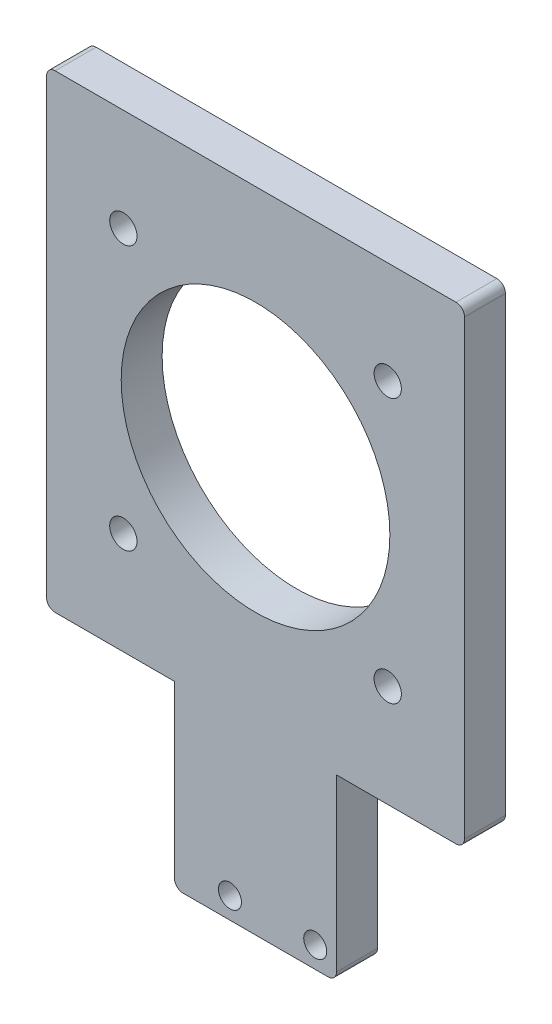
from build123d import *

# Parameters (mm, degrees)
ESQUISSE1_R        = 15.75
ESQUISSE1_R_2      = 1.6
ESQUISSE1_R_3      = 1.35
BOSS_EXTRU_1_DEPTH = 4.8


with BuildPart() as part:
    # Esquisse1 → Boss.-Extru.1 (new body)
    with BuildSketch(Plane(origin=(0, 0, 0), x_dir=(-1, 0, 0), z_dir=(0, 0, -1))):
        with BuildLine():
            Line((-12.0004012, 3.650219609), (-12.0004012, 56.650219609))
            ThreePointArc((-12.0004012, 56.650219609), (-12.293294419, 57.35732639), (-13.0004012, 57.650219609))
            Line((-13.0004012, 57.650219609), (-60.0004012, 57.650219609))
            ThreePointArc((-60.0004012, 57.650219609), (-60.707507981, 57.35732639), (-61.0004012, 56.650219609))
            Line((-61.0004012, 56.650219609), (-61.0004012, 3.650219609))
            ThreePointArc((-61.0004012, 3.650219609), (-60.707507981, 2.943112828), (-60.0004012, 2.650219609))
            Line((-60.0004012, 2.650219609), (-46.0004012, 2.650219609))
            Line((-46.0004012, 2.650219609), (-46.0004012, -17.349780391))
            ThreePointArc((-46.0004012, -17.349780391), (-45.707507981, -18.056887172), (-45.0004012, -18.349780391))
            Line((-45.0004012, -18.349780391), (-28.0004012, -18.349780391))
            ThreePointArc((-28.0004012, -18.349780391), (-27.293294419, -18.056887172), (-27.0004012, -17.349780391))
            Line((-27.0004012, -17.349780391), (-27.0004012, 2.650219609))
            Line((-27.0004012, 2.650219609), (-13.0004012, 2.650219609))
            ThreePointArc((-13.0004012, 2.650219609), (-12.293294419, 2.943112828), (-12.0004012, 3.650219609))
        make_face()
        with Locations((-36.5004012, 30.150219609)):
            Circle(ESQUISSE1_R, mode=Mode.SUBTRACT)
        with Locations((-52.0004012, 14.650219609)):
            Circle(ESQUISSE1_R_2, mode=Mode.SUBTRACT)
        with Locations((-52.000444233, 45.650219609)):
            Circle(ESQUISSE1_R_2, mode=Mode.SUBTRACT)
        with Locations((-21.0004012, 14.650219609)):
            Circle(ESQUISSE1_R_2, mode=Mode.SUBTRACT)
        with Locations((-21.0004012, 45.650219609)):
            Circle(ESQUISSE1_R_2, mode=Mode.SUBTRACT)
        with Locations((-43.5004012, -15.849780391)):
            Circle(ESQUISSE1_R_3, mode=Mode.SUBTRACT)
        with Locations((-33.5004012, -15.849780391)):
            Circle(ESQUISSE1_R_3, mode=Mode.SUBTRACT)
    extrude(amount=-BOSS_EXTRU_1_DEPTH)


solid = part.part
